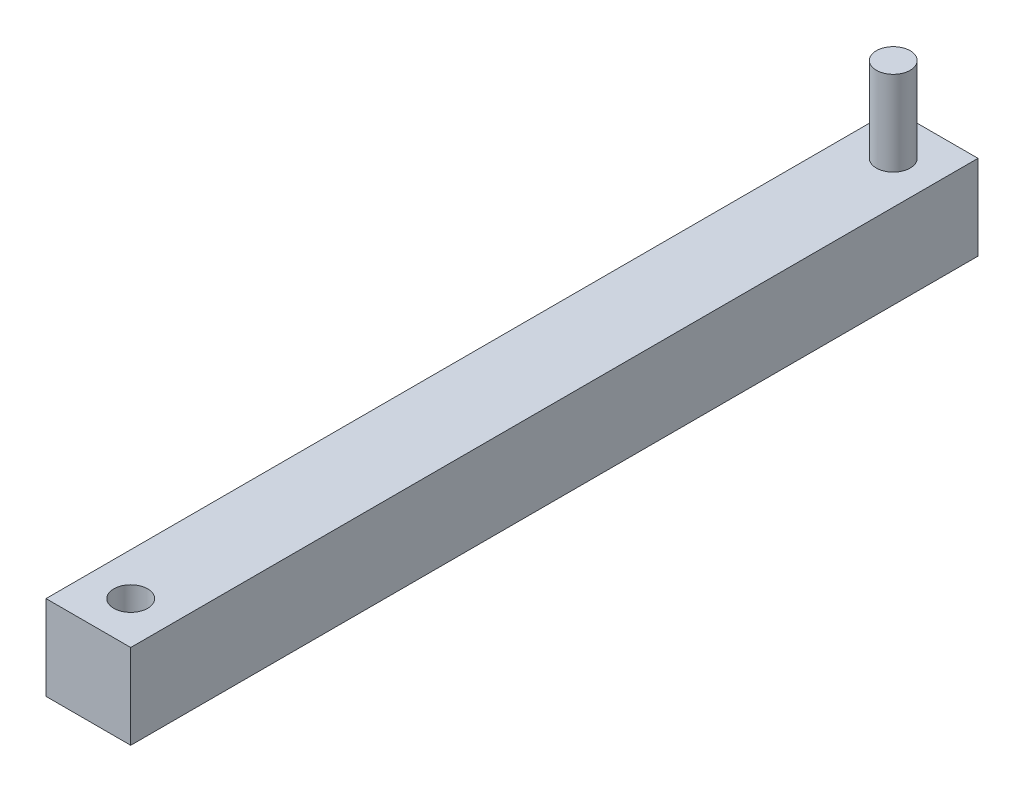
from build123d import *

# Parameters (mm, degrees)
SKETCH2_W           = 10
SKETCH2_H           = 10
BOSS_EXTRUDE1_DEPTH = 100
CUT_EXTRUDE1_REACH  = 102.623
SKETCH3_R           = 2
SKETCH4_R           = 2
BOSS_EXTRUDE2_DEPTH = 10


with BuildPart() as part:
    # Sketch2 → Boss-Extrude1 (new body)
    with BuildSketch(Plane.XY):
        Rectangle(SKETCH2_W, SKETCH2_H)
    extrude(amount=BOSS_EXTRUDE1_DEPTH)

    # Sketch3 → Cut-Extrude1 (cut, up to next)
    with BuildSketch(Plane(origin=(0, 5, 0), x_dir=(1, 0, 0), z_dir=(0, 1, 0)), mode=Mode.PRIVATE) as cut_extrude1_sk1:
        with Locations(Location((0, -95, 0), (0, 0, 270))):
            Circle(SKETCH3_R)
    cut_extrude1_tool1 = extrude(cut_extrude1_sk1.sketch, amount=-CUT_EXTRUDE1_REACH, mode=Mode.PRIVATE) & part.part
    add(cut_extrude1_tool1.solids().sort_by_distance((0, 5, 95))[0], mode=Mode.SUBTRACT)

    # Sketch4 → Boss-Extrude2 (add)
    with BuildSketch(Plane(origin=(0, 5, 0), x_dir=(1, 0, 0), z_dir=(0, 1, 0))):
        with Locations(Location((0, -5, 0), (0, 0, 90))):
            Circle(SKETCH4_R)
    extrude(amount=BOSS_EXTRUDE2_DEPTH)


solid = part.part
